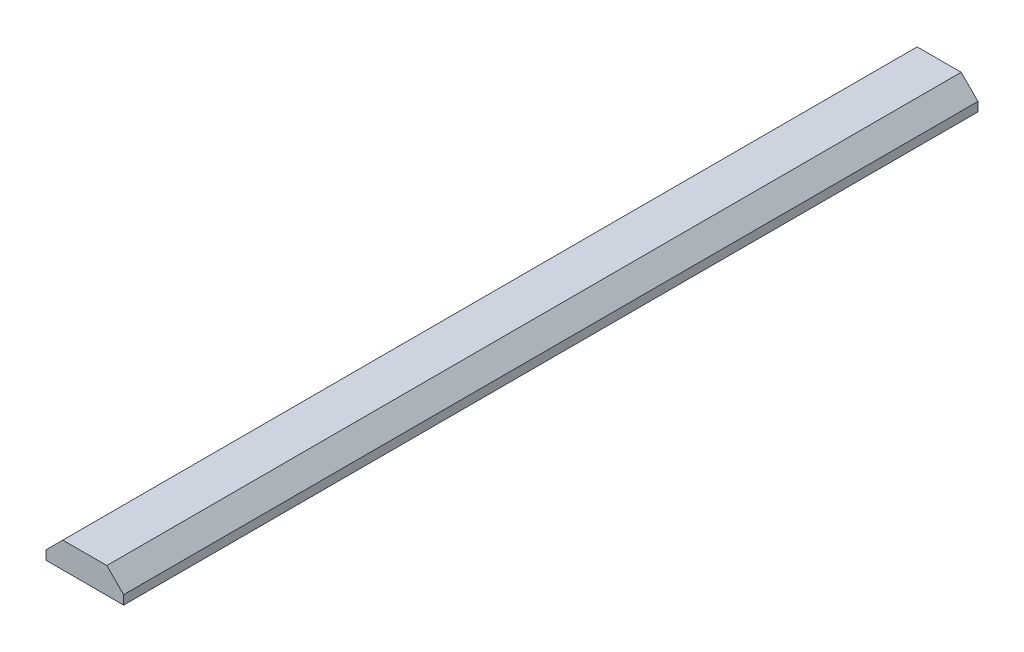
from build123d import *

# Parameters (mm, degrees)
AUFSATZ_LINEAR_AUSTRAGEN1_DEPTH = 132


with BuildPart() as part:
    # Skizze1 → Aufsatz-Linear austragen1 (new body)
    with BuildSketch(Plane.XY):
        Polygon((3.4, 1.808858787), (-3.4, 1.808858787), (-6, -0.791141213), (-6, -2.191141213), (6, -2.191141213), (6, -0.791141213), align=None)
    extrude(amount=AUFSATZ_LINEAR_AUSTRAGEN1_DEPTH)


solid = part.part
